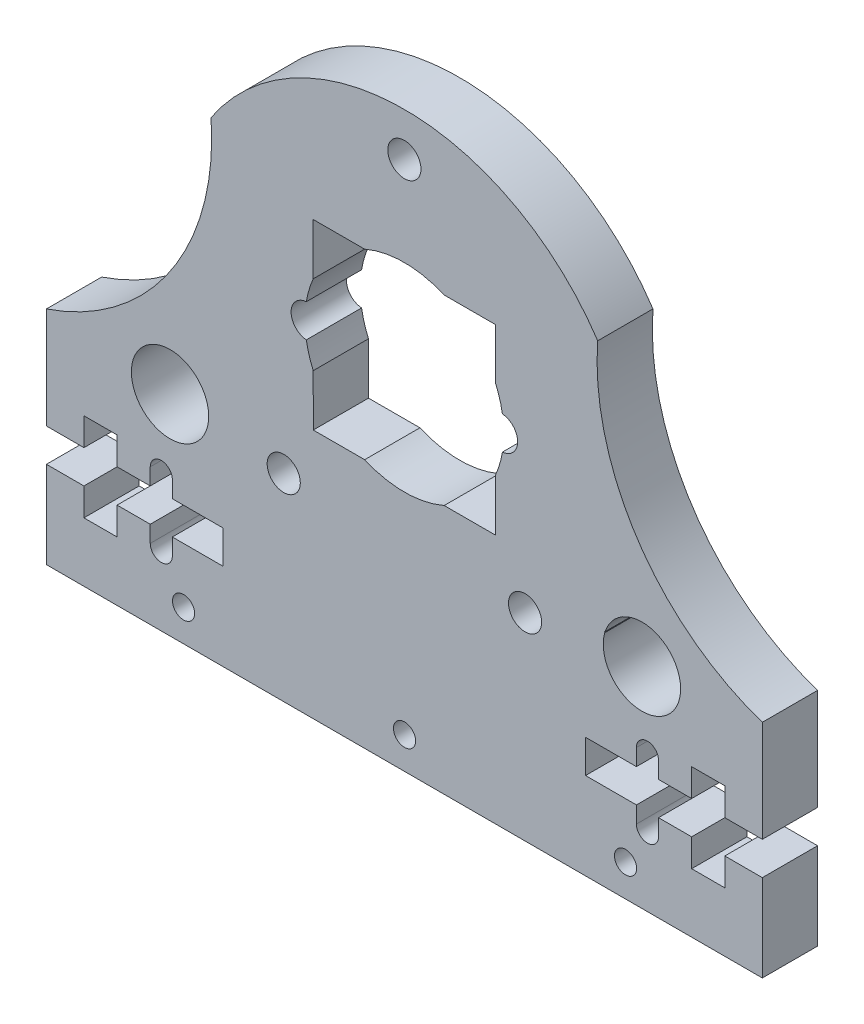
from build123d import *
from build123d.topology import SkipClean

# Parameters (mm, degrees)
SKETCH1_R           = 3.5
SKETCH1_R_2         = 1.5
BOSS_EXTRUDE1_DEPTH = 5
SKETCH2_W           = 3
SKETCH2_H           = 8
SKETCH2_W_2         = 16
SKETCH2_H_2         = 3
CUT_EXTRUDE3_DEPTH  = 10
SKETCH4_OUTSIDE_W   = 83.878
SKETCH4_OUTSIDE_H   = 74.539
CUT_EXTRUDE5_DEPTH  = 10
BOSS_EXTRUDE2_DEPTH = 5
SKETCH5_R           = 1
CUT_EXTRUDE6_DEPTH  = 5
CUT_EXTRUDE7_DEPTH  = 46.035343011


with BuildPart() as part:
    # Sketch1 → Boss-Extrude1 (new body)
    with BuildSketch(Plane.XY):
        with BuildLine():
            Line((16.678684739, -6.865443356), (7.048954955, 19.63254949))
            ThreePointArc((7.048954955, 19.63254949), (-0.000574134, 24.570863688), (-7.049347073, 19.631470247))
            Line((-7.049347073, 19.631470247), (-16.60248251, -6.668301445))
            ThreePointArc((-16.60248251, -6.668301445), (-23.589225287, -5.352701736), (-28.111762071, -10.838322782))
            Line((-28.111762071, -10.838322782), (-32.396038203, -10.838322782))
            Line((-32.396038203, -10.838322782), (-32.396038203, -30.881690835))
            Line((-32.396038203, -30.881690835), (32.396038203, -30.881690835))
            Line((32.396038203, -30.881690835), (32.396038203, -10.838322782))
            Line((32.396038203, -10.838322782), (28.403544795, -10.838322782))
            ThreePointArc((28.403544795, -10.838322782), (23.74315896, -5.304380506), (16.678684739, -6.865443356))
        make_face()
        with BuildLine():
            Line((18.109177542, -10.838322782), (18.172818569, -10.838322782))
            ThreePointArc((18.172818569, -10.838322782), (24.845541744, -12.952957548), (18.140100673, -10.944481806))
            ThreePointArc((18.140100673, -10.944481806), (18.124834746, -10.891345307), (18.109177542, -10.838322782))
        make_face(mode=Mode.SUBTRACT)
        with BuildLine():
            ThreePointArc((-10.753093745, -20.488849886), (-10.919568848, -20.490697711), (-11.086043951, -20.488849886))
            Line((-11.086043951, -20.488849886), (-10.753093745, -20.488849886))
        make_face(mode=Mode.SUBTRACT)
        with Locations((-21.209007359, -11.922115015)):
            Circle(SKETCH1_R, mode=Mode.SUBTRACT)
        with BuildLine():
            Line((3.592595297, 8.251863973), (8.245757774, 8.254276772))
            Line((8.245757774, 8.254276772), (8.248133809, 3.67201473))
            ThreePointArc((8.248133809, 3.67201473), (8.625435504, 2.640272663), (8.874223719, 1.570248043))
            ThreePointArc((8.874223719, 1.570248043), (10.249998622, 0.076178628), (8.875773895, -1.41931674))
            ThreePointArc((8.875773895, -1.41931674), (8.62809549, -2.489598792), (8.251863973, -3.521731588))
            Line((8.251863973, -3.521731588), (8.254313497, -8.24572101))
            Line((8.254313497, -8.24572101), (3.601151021, -8.248133809))
            ThreePointArc((3.601151021, -8.248133809), (0.004666758, -8.99999879), (-3.592595297, -8.251863973))
            Line((-3.592595297, -8.251863973), (-8.245721029, -8.254276752))
            Line((-8.245721029, -8.254276752), (-8.248133809, -3.601151021))
            ThreePointArc((-8.248133809, -3.601151021), (-8.625435504, -2.569408953), (-8.874223719, -1.499384334))
            ThreePointArc((-8.874223719, -1.499384334), (-10.249998622, -0.005314919), (-8.875773895, 1.49018045))
            ThreePointArc((-8.875773895, 1.49018045), (-8.62809549, 2.560462502), (-8.251863973, 3.592595297))
            Line((-8.251863973, 3.592595297), (-8.254276752, 8.245721029))
            Line((-8.254276752, 8.245721029), (-3.601151021, 8.248133809))
            ThreePointArc((-3.601151021, 8.248133809), (-0.004666758, 8.99999879), (3.592595297, 8.251863973))
        make_face(mode=Mode.SUBTRACT)
        with Locations((0, 17.070863709)):
            Circle(SKETCH1_R_2, mode=Mode.SUBTRACT)
        with Locations((-10.919568848, -12.990697711)):
            Circle(SKETCH1_R_2, mode=Mode.SUBTRACT)
        with Locations((10.924107384, -12.988849886)):
            Circle(SKETCH1_R_2, mode=Mode.SUBTRACT)
    extrude(amount=BOSS_EXTRUDE1_DEPTH)

    # Sketch2 → Cut-Extrude3 (cut)
    with BuildSketch(Plane.XY.offset(5)):
        with Locations((27.500296009, -21.513780425)):
            Rectangle(SKETCH2_W, SKETCH2_H)
        with Locations((24.396038203, -21.513780425)):
            Rectangle(SKETCH2_W_2, SKETCH2_H_2)
        with BuildLine():
            Line((23.000296009, -18.513780425), (23.000296009, -24.513780425))
            ThreePointArc((23.000296009, -24.513780425), (22.000296009, -25.513780425), (21.000296009, -24.513780425))
            Line((21.000296009, -24.513780425), (21.000296009, -18.513780425))
            ThreePointArc((21.000296009, -18.513780425), (22.000296009, -17.513780425), (23.000296009, -18.513780425))
        make_face()
    cut_extrude3 = extrude(amount=-CUT_EXTRUDE3_DEPTH, mode=Mode.SUBTRACT)

    # Mirror1: Cut-Extrude3 across plane
    add(cut_extrude3.mirror(Plane(origin=(0, 0, 0), x_dir=(0, 0, 1), z_dir=(1, 0, 0))), mode=Mode.SUBTRACT)

    # Sketch4 outside → Cut-Extrude5 (cut)
    with BuildSketch(Plane.XY.offset(5)):
        with Locations((0, -3.1555)):
            Rectangle(SKETCH4_OUTSIDE_W, SKETCH4_OUTSIDE_H)
        with BuildLine():
            Line((-32.396038203, -10.838322782), (-17.497591027, 11.611817612))
            ThreePointArc((-17.497591027, 11.611817612), (0, 21), (17.497591027, 11.611817612))
            Line((17.497591027, 11.611817612), (32.396038203, -10.838322782))
            Line((32.396038203, -10.838322782), (32.396038203, -30.881690835))
            Line((32.396038203, -30.881690835), (-32.396038203, -30.881690835))
            Line((-32.396038203, -30.881690835), (-32.396038203, -10.838322782))
        make_face(mode=Mode.SUBTRACT)
    extrude(amount=-CUT_EXTRUDE5_DEPTH, mode=Mode.SUBTRACT)

    # Sketch4<5> → Boss-Extrude2 (add)
    with SkipClean():  # the faces are left unmerged after this step: merging them gives an invalid solid
        with BuildSketch(Plane.XY.offset(5)):
            with BuildLine():
                Line((-17.497591027, 11.611817612), (-32.396038203, -10.838322782))
                Line((-32.396038203, -10.838322782), (-28.111762071, -10.838322782))
                ThreePointArc((-28.111762071, -10.838322782), (-23.589225287, -5.352701736), (-16.60248251, -6.668301445))
                Line((-16.60248251, -6.668301445), (-7.049347073, 19.631470247))
                Line((-7.049347073, 19.631470247), (-6.984017788, 19.804633184))
                ThreePointArc((-6.984017788, 19.804633184), (-12.90805366, 16.564484619), (-17.497591027, 11.611817612))
            make_face()
            with BuildLine():
                ThreePointArc((17.497591027, 11.611817612), (12.90805366, 16.564484619), (6.984017788, 19.804633184))
                Line((6.984017788, 19.804633184), (7.048954955, 19.63254949))
                Line((7.048954955, 19.63254949), (16.678684739, -6.865443356))
                ThreePointArc((16.678684739, -6.865443356), (23.74315896, -5.304380506), (28.403544795, -10.838322782))
                Line((28.403544795, -10.838322782), (32.396038203, -10.838322782))
                Line((32.396038203, -10.838322782), (17.497591027, 11.611817612))
            make_face()
        extrude(amount=-BOSS_EXTRUDE2_DEPTH)

    # Sketch5 → Cut-Extrude6 (cut)
    with SkipClean():  # the faces are left unmerged after this step: merging them gives an invalid solid
        with BuildSketch(Plane.XY.offset(5)):
            with Locations((0.014555548, -27.999996217)):
                Circle(SKETCH5_R)
            with Locations((20.014552859, -27.989625643)):
                Circle(SKETCH5_R)
            with Locations((-19.985441764, -28.01036679)):
                Circle(SKETCH5_R)
        extrude(amount=-CUT_EXTRUDE6_DEPTH, mode=Mode.SUBTRACT)

    # Sketch6 → Cut-Extrude7 (cut, through all)
    with SkipClean():  # the faces are left unmerged after this step: merging them gives an invalid solid
        with BuildSketch(Plane.XY.offset(5)):
            with BuildLine():
                ThreePointArc((-32.396038203, -10.838322782), (-21.107946915, -2.160816504), (-17.497591027, 11.611817612))
                ThreePointArc((-17.497591027, 11.611817612), (-30.842179781, 4.299051969), (-32.396038203, -10.838322782))
            make_face()
            with BuildLine():
                ThreePointArc((32.396038203, -10.838322782), (21.107946915, -2.160816504), (17.497591027, 11.611817612))
                ThreePointArc((17.497591027, 11.611817612), (30.860111099, 4.310951618), (32.396038203, -10.838322782))
            make_face()
        extrude(amount=-CUT_EXTRUDE7_DEPTH, mode=Mode.SUBTRACT)


solid = part.part
